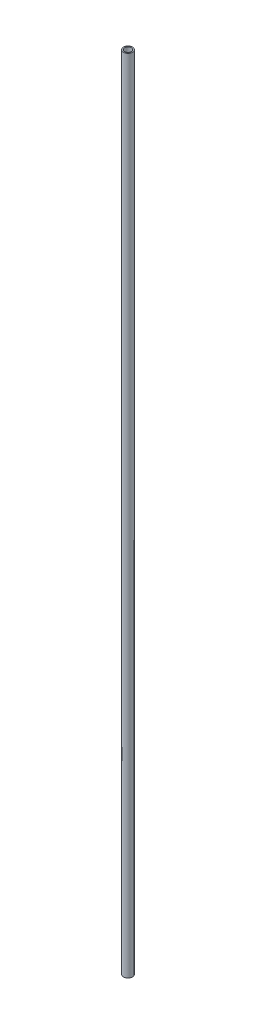
from build123d import *

# Parameters (mm, degrees)
SKETCH1_R           = 4
SKETCH1_R_2         = 3
BOSS_EXTRUDE1_DEPTH = 355


with BuildPart() as part:
    # Sketch1 → Boss-Extrude1 (new, symmetric)
    with BuildSketch(Plane(origin=(0, 0, 0), x_dir=(1, 0, 0), z_dir=(0, 1, 0))):
        with Locations(Location((0, 0, 0), (0, 0, 270))):
            Circle(SKETCH1_R)
        with Locations(Location((0, 0, 0), (0, 0, 270))):
            Circle(SKETCH1_R_2, mode=Mode.SUBTRACT)
    extrude(amount=BOSS_EXTRUDE1_DEPTH, both=True)


solid = part.part
